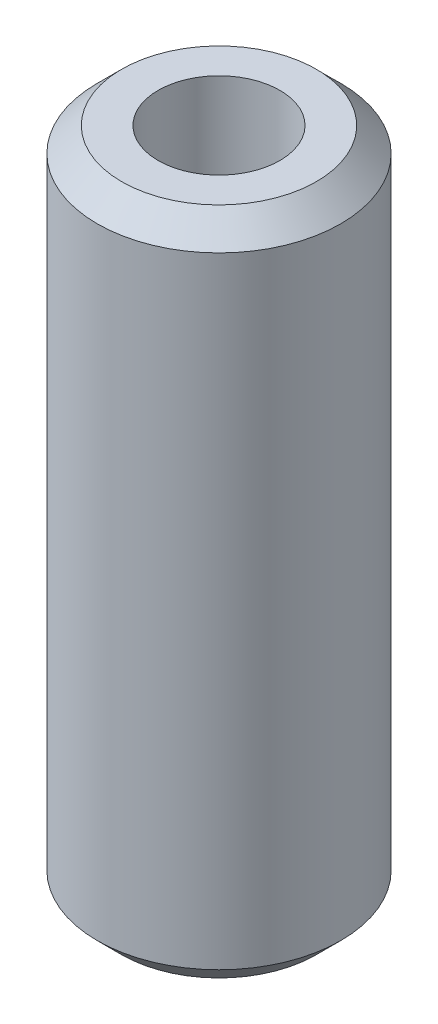
from build123d import *

# Parameters (mm, degrees)
SKETCH1_R           = 12.7
SKETCH1_R_2         = 6.35
BOSS_EXTRUDE1_DEPTH = 34.925
CHAMFER1_SIZE       = 2.54


with BuildPart() as part:
    # Sketch1 → Boss-Extrude1 (new, symmetric)
    with BuildSketch(Plane(origin=(0, 0, 0), x_dir=(1, 0, 0), z_dir=(0, 1, 0))):
        with Locations(Location((0, 0, 0), (0, 0, 270))):
            Circle(SKETCH1_R)
        with Locations(Location((0, 0, 0), (0, 0, 270))):
            Circle(SKETCH1_R_2, mode=Mode.SUBTRACT)
    extrude(amount=BOSS_EXTRUDE1_DEPTH, both=True)

    # Chamfer1
    chamfer1_edges = [part.edges().sort_by_distance(p)[0] for p in [
        (0, -34.925, -12.7),
        (0, 34.925, -12.7),
    ]]
    chamfer(chamfer1_edges, length=CHAMFER1_SIZE)


solid = part.part
